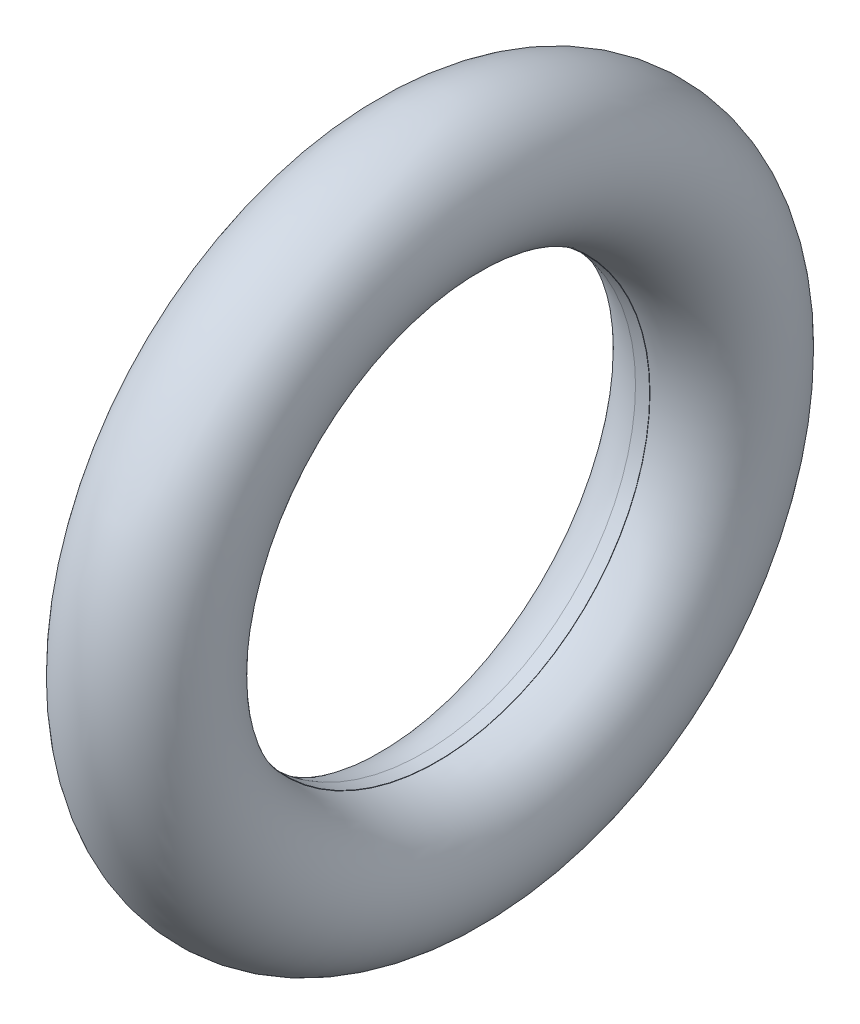
from build123d import *


with BuildPart() as part:
    # Sketch1 → Revolve1 (revolve)
    with BuildSketch(Plane.XY, mode=Mode.PRIVATE) as revolve1_sk:
        with BuildLine():
            Line((0.9, 3), (1, 3))
            Line((1, 3), (1.1, 3))
            Line((1.1, 3), (1.1, 3.005012563))
            ThreePointArc((1.1, 3.005012563), (1, 5), (0.9, 3.005012563))
            Line((0.9, 3.005012563), (0.9, 3))
        make_face()
    revolve(revolve1_sk.sketch.rotate(Axis((0, 0, 0), (1, 0, 0)), 90), axis=Axis((0, 0, 0), (1, 0, 0)))


solid = part.part
